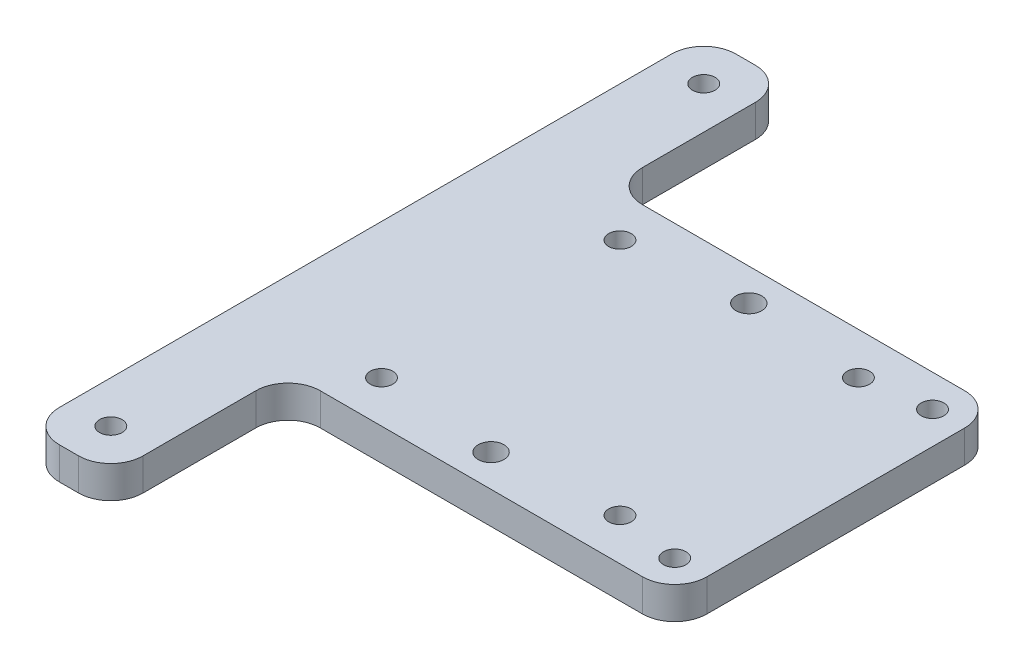
from build123d import *

# Parameters (mm, degrees)
EXTRUDE_1_DEPTH     = 5
FILLET_1_R          = 5
SKETCH_7_R          = 1.75
CUT_EXTRUDE_5_DEPTH = 91.056926441
SKETCH_8_R          = 1.75
CUT_EXTRUDE_6_DEPTH = 91.056926441
SKETCH_9_R          = 1.75
SKETCH_9_R_2        = 2
CUT_EXTRUDE_7_DEPTH = 91.056926441


with BuildPart() as part:
    # 스케치2 → 보스-돌출1 (new body)
    with BuildSketch(Plane(origin=(0, 0, 0), x_dir=(1, 0, 0), z_dir=(0, 1, 0))):
        Polygon((-60, -25), (-60, -52.5), (-73, -52.5), (-73, 52.5), (-60, 52.5), (-60, 25), (0, 25), (0, -25), align=None)
    extrude(amount=EXTRUDE_1_DEPTH)

    # 필렛1
    fillet_1_edges = [part.edges().sort_by_distance(p)[0] for p in [
        (0, 2.5, 25),
        (-60, 2.5, 25),
        (-60, 2.5, 52.5),
        (-73, 2.5, 52.5),
        (-73, 2.5, -52.5),
        (-60, 2.5, -52.5),
        (-60, 2.5, -25),
        (0, 2.5, -25),
    ]]
    fillet(fillet_1_edges, radius=FILLET_1_R)

    # 스케치7 → 컷-돌출5 (cut, through all)
    with BuildSketch(Plane.XZ):
        with Locations(Location((-66.5, -46, 0), (0, 0, 270))):
            Circle(SKETCH_7_R)
        with Locations(Location((-66.5, 46, 0), (0, 0, 270))):
            Circle(SKETCH_7_R)
    extrude(amount=-CUT_EXTRUDE_5_DEPTH, mode=Mode.SUBTRACT)

    # 스케치8 → 컷-돌출6 (cut, through all)
    with BuildSketch(Plane(origin=(0, 5, 0), x_dir=(1, 0, 0), z_dir=(0, 1, 0))):
        with Locations(Location((-5, 20, 0), (0, 0, 270))):
            Circle(SKETCH_8_R)
        with Locations(Location((-5, -20, 0), (0, 0, 270))):
            Circle(SKETCH_8_R)
    extrude(amount=-CUT_EXTRUDE_6_DEPTH, mode=Mode.SUBTRACT)

    # 스케치9 → 컷-돌출7 (cut, through all)
    with BuildSketch(Plane(origin=(0, 5, 0), x_dir=(1, 0, 0), z_dir=(0, 1, 0))):
        with Locations(Location((-52, 18.5, 0), (0, 0, 270))):
            Circle(SKETCH_9_R)
        with Locations(Location((-52, -18.5, 0), (0, 0, 270))):
            Circle(SKETCH_9_R)
        with Locations(Location((-15, -18.5, 0), (0, 0, 270))):
            Circle(SKETCH_9_R)
        with Locations(Location((-15, 18.5, 0), (0, 0, 270))):
            Circle(SKETCH_9_R)
        with Locations(Location((-33.5, 20, 0), (0, 0, 270))):
            Circle(SKETCH_9_R_2)
        with Locations(Location((-33.5, -20, 0), (0, 0, 270))):
            Circle(SKETCH_9_R_2)
    extrude(amount=-CUT_EXTRUDE_7_DEPTH, mode=Mode.SUBTRACT)


solid = part.part
